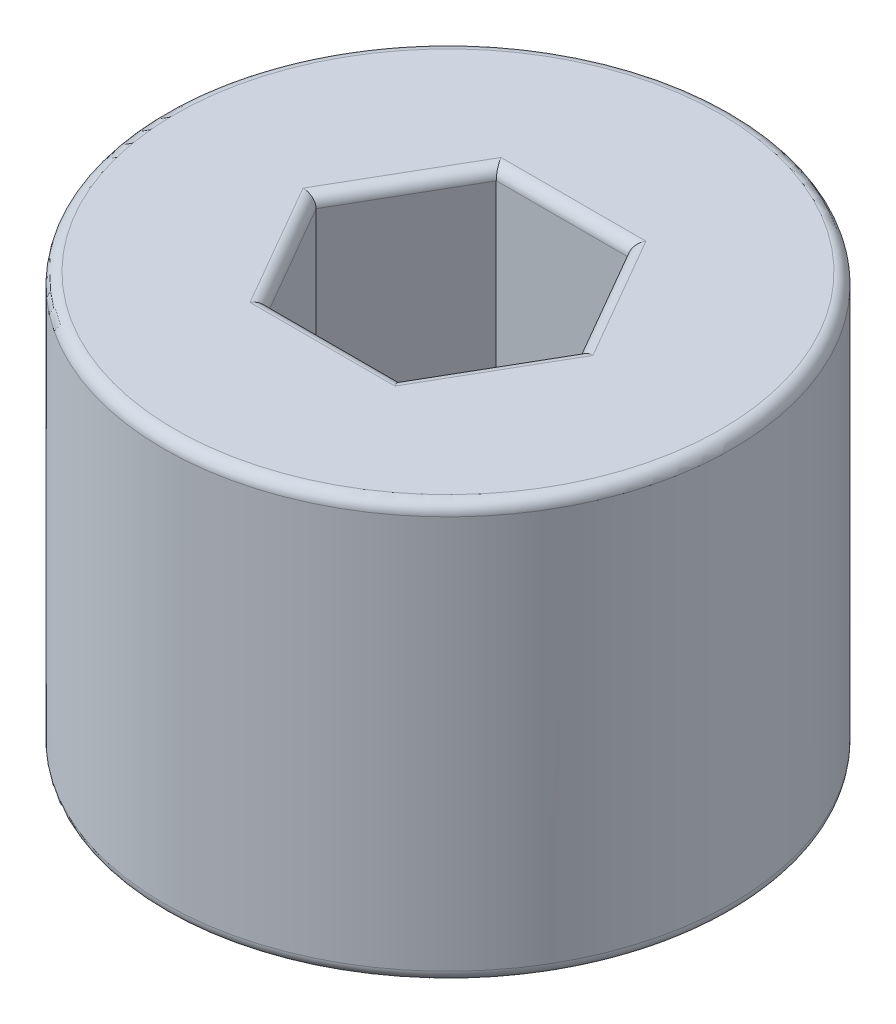
from build123d import *

# Parameters (mm, degrees)
CUT_EXTRUDE1_DEPTH = 35.421953112
FILLET1_R          = 0.635
FILLET2_R          = 2.032


with BuildPart() as part:
    # Sketch3 → Revolve1 (revolve)
    with BuildSketch(Plane(origin=(0, 0, 0), x_dir=(0, 0, -1), z_dir=(1, 0, 0)), mode=Mode.PRIVATE) as revolve1_sk:
        Polygon((6.4135, 0), (6.4135, -25.9842), (10.16, -25.9842), (10.16, -23.368), (15.9639, -23.368), (15.9639, 0), align=None)
    revolve(revolve1_sk.sketch.rotate(Axis((0, 17.16060519, 0), (0, -1, 0)), 180), axis=Axis((0, 17.16060519, 0), (0, -1, 0)))

    # Sketch2 → Cut-Extrude1 (cut, through all)
    with BuildSketch(Plane(origin=(0, 0, 0), x_dir=(1, 0, 0), z_dir=(0, 1, 0))):
        Polygon((7.405671903, 0), (3.702835951, 6.4135), (-3.702835951, 6.4135), (-7.405671903, 0), (-3.702835951, -6.4135), (3.702835951, -6.4135), align=None)
    extrude(amount=-CUT_EXTRUDE1_DEPTH, mode=Mode.SUBTRACT)

    # Fillet1
    fillet1_edges = [part.edges().sort_by_distance(p)[0] for p in [
        (5.554253927, -25.9842, -3.20675),
        (5.554253927, -25.9842, 3.20675),
        (0, -25.9842, -6.4135),
        (0, -25.9842, 6.4135),
        (-5.554253927, -25.9842, -3.20675),
        (-5.554253927, -25.9842, 3.20675),
        (0, 0, 6.4135),
        (-5.554253927, 0, 3.20675),
        (-5.554253927, 0, -3.20675),
        (0, 0, -6.4135),
        (5.554253927, 0, -3.20675),
        (5.554253927, 0, 3.20675),
        (0, 0, -15.9639),
        (0, -23.368, -15.9639),
        (0, -25.9842, -10.16),
    ]]
    fillet(fillet1_edges, radius=FILLET1_R)

    # Fillet2
    fillet2_edges = [part.edges().sort_by_distance(p)[0] for p in [
        (0, -23.368, -10.16),
    ]]
    fillet(fillet2_edges, radius=FILLET2_R)


solid = part.part
